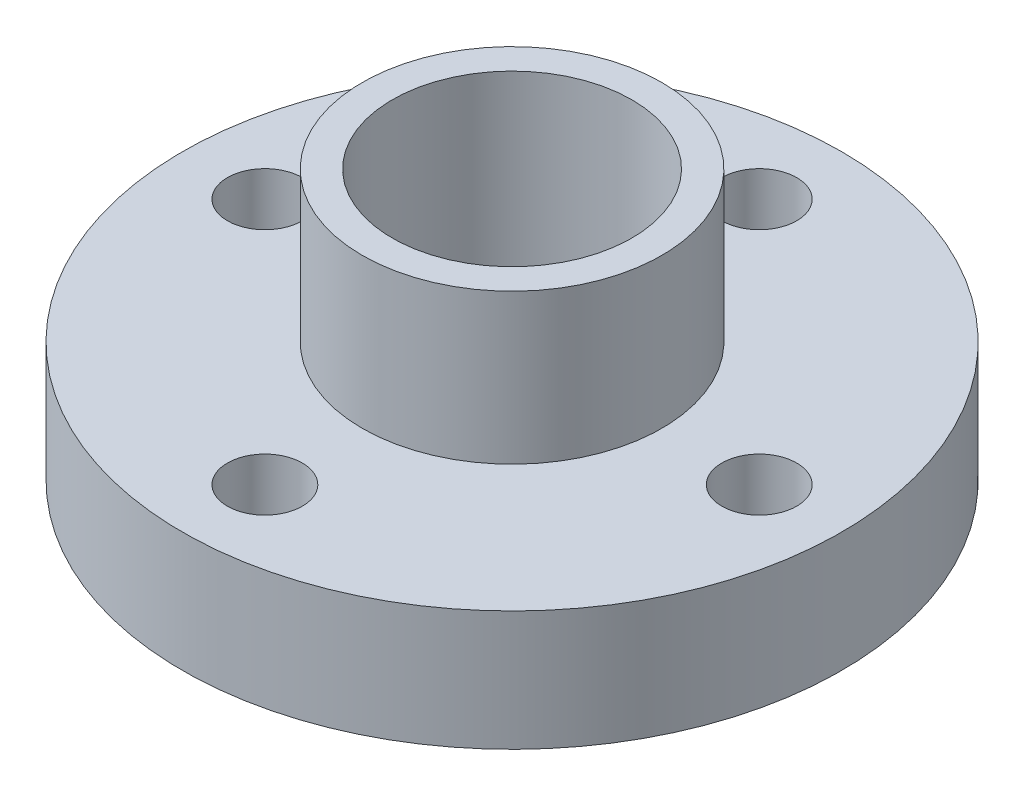
from build123d import *

# Parameters (mm, degrees)
TAP_DRILL_FOR_M3_TAP1_D = 2.5


with BuildPart() as part:
    # Sketch1 → Revolve1 (revolve)
    with BuildSketch(Plane.XY, mode=Mode.PRIVATE) as revolve1_sk:
        Polygon((11, 0), (11, 4), (5, 4), (5, 9), (4, 9), (4, -2), (5, -2), (5, 0), align=None)
    revolve(revolve1_sk.sketch.rotate(Axis((0, 0, 0), (0, 1, 0)), 90), axis=Axis((0, 0, 0), (0, 1, 0)))

    # Tap Drill for M3 Tap1 (through all)
    with Locations(Plane(origin=(0, 4, 0), x_dir=(1, 0, 0), z_dir=(0, 1, 0))):
        with Locations((0, 8.25), (8.25, 0), (0, -8.25), (-8.25, 0)):
            Hole(TAP_DRILL_FOR_M3_TAP1_D / 2)


solid = part.part
